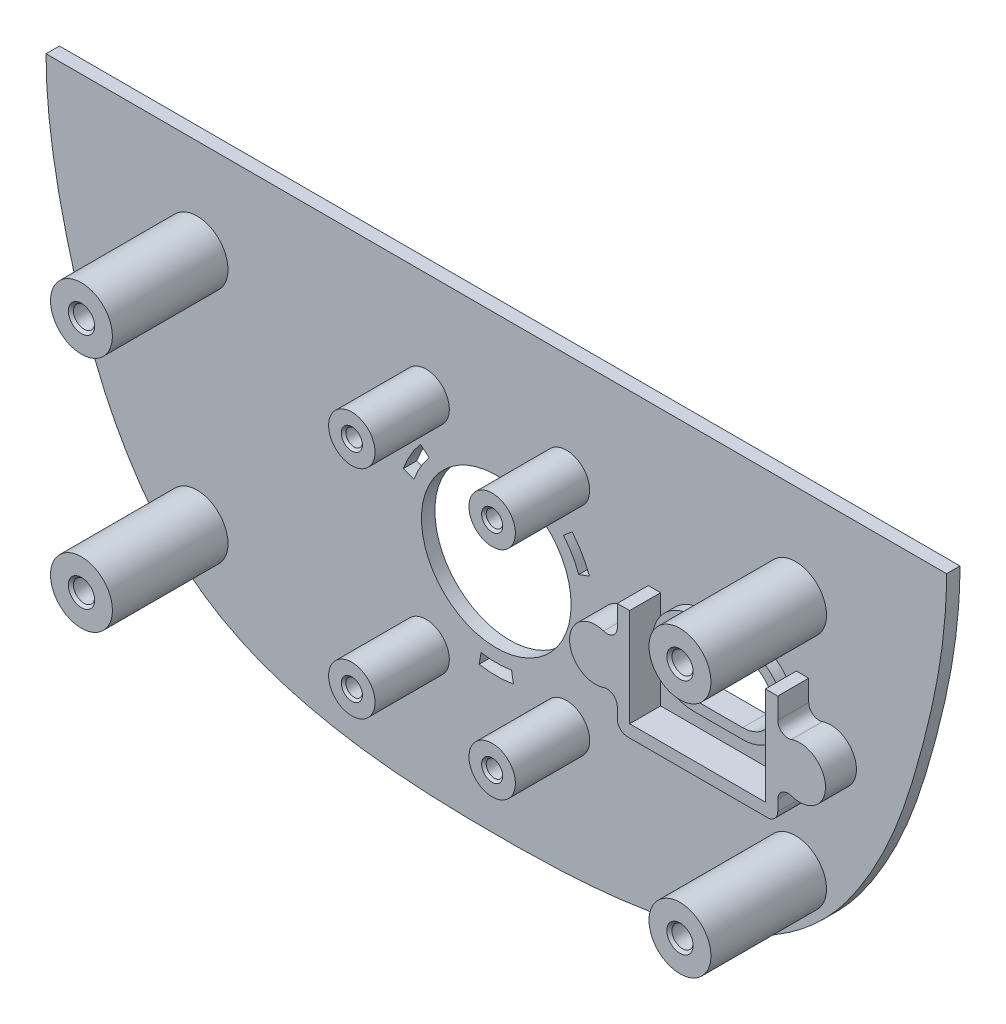
from build123d import *

# Parameters (mm, degrees)
EXTRUDE_1_DEPTH            = 1.3
SKETCH_2_R                 = 7.25
CUT_EXTRUDE_1_DEPTH        = 50.312390323
SKETCH_3_R                 = 3
SKETCH_3_R_2               = 2.25
EXTRUDE_2_DEPTH            = 7.2
SKETCH_4_R                 = 3
EXTRUDE_3_DEPTH            = 4
MIRROR_2_COPY_1_SKETCH_R   = 3
MIRROR_2_COPY_1_SKETCH_R_2 = 2.25
MIRROR_2_COPY_1_DEPTH      = 7.2
MIRROR_2_COPY_2_SKETCH_R   = 3
MIRROR_2_COPY_2_DEPTH      = 4
EXTRUDE_4_DEPTH            = 3
FILLET_1_R                 = 1
FILLET_2_R                 = 1
EXTRUDE_START              = 1
EXTRUDE_5_DEPTH            = 1
CUT_EXTRUDE_2_DEPTH        = 51.55157603


with BuildPart() as part:
    # 草图1 → 凸台-拉伸1 (new body)
    with BuildSketch(Plane.XY):
        with BuildLine():
            Line((-43.633908228, 20.8), (43.633908228, 20.8))
            add(Edge.make_bspline(
                [(43.633908228, 20.8), (43.633896186, 17.816441154), (43.166045606, 13.328317386), (41.935324687, 7.509911363), (40.780952583, 3.186512197), (39.471395291, -1.111683209), (37.800525429, -5.22041407), (35.689427738, -9.129621878), (33.132571088, -12.818032554), (29.982182395, -15.901512088), (26.249796115, -18.401728658), (22.196514099, -20.181654454), (16.429421746, -21.80470371), (9.014993789, -22.806165917), (0.016756126, -23.00176122), (-7.476640254, -22.840714569), (-13.430491813, -22.21049193), (-17.810447542, -21.410467341), (-22.102304365, -20.216812762), (-26.228858355, -18.41387049), (-29.298252959, -16.365199214), (-31.546858625, -14.375635283), (-33.552102976, -12.208905462), (-35.673711859, -9.157404868), (-37.81373488, -5.199904301), (-39.498586631, -1.033740187), (-41.230355142, 4.669994883), (-42.656919664, 10.435368542), (-43.478245905, 16.300477659), (-43.633914514, 19.304309804), (-43.633908228, 20.8)],
                knots=[0, 0, 0, 0, 0.0625, 0.09375, 0.125, 0.15625, 0.1875, 0.21875, 0.25, 0.28125, 0.3125, 0.34375, 0.375, 0.4375, 0.5, 0.5625, 0.59375, 0.625, 0.65625, 0.6875, 0.71875, 0.734375, 0.75, 0.78125, 0.8125, 0.84375, 0.875, 0.9375, 0.96875, 1, 1, 1, 1], degree=3))
        make_face()
    extrude(amount=-EXTRUDE_1_DEPTH)

    # 草图2 → 切除-拉伸1 (cut, through all)
    with BuildSketch(Plane.XY):
        Circle(SKETCH_2_R)
        with BuildLine():
            Line((20.125, 5), (24.875, 5))
            ThreePointArc((24.875, 5), (27.875, 2), (24.875, -1))
            Line((24.875, -1), (20.125, -1))
            ThreePointArc((20.125, -1), (17.125, 2), (20.125, 5))
        make_face()
    extrude(amount=-CUT_EXTRUDE_1_DEPTH, mode=Mode.SUBTRACT)

    # 草图3 → 凸台-拉伸2 (add)
    with BuildSketch(Plane.XY):
        with Locations((-29, 11.5)):
            Circle(SKETCH_3_R)
        with Locations((-6.8, 10.5)):
            Circle(SKETCH_3_R_2)
    extrude_2 = extrude(amount=EXTRUDE_2_DEPTH)

    # 草图4 → 凸台-拉伸3 (add)
    with BuildSketch(Plane.XY.offset(7.2)):
        with Locations((-29, 11.5)):
            Circle(SKETCH_4_R)
    extrude_3 = extrude(amount=EXTRUDE_3_DEPTH)

    # 草图6 → M2 螺纹孔1 (revolve, cut)
    with BuildSketch(Plane(origin=(-6.8, 10.5, 7.2), x_dir=(0, -1, 0), z_dir=(1, 0, 0))):
        Polygon((0, 0), (0, 5.680688495), (0.8, 5.2), (0.8, 0.225), (1.025, 0), align=None)
    hole_wizard_m2_1 = revolve(axis=Axis((-6.8, 10.5, 13.55), (0, 0, -1)), mode=Mode.SUBTRACT)

    # 草图8 → M2.5 螺纹孔1 (revolve, cut)
    with BuildSketch(Plane(origin=(-29, 11.5, 11.2), x_dir=(0, -1, 0), z_dir=(1, 0, 0))):
        Polygon((0, 0), (0, 6.965882135), (1.025, 6.35), (1.025, 0.25), (1.275, 0), align=None)
    hole_wizard_m2_5_1 = revolve(axis=Axis((-29, 11.5, 17.55), (0, 0, -1)), mode=Mode.SUBTRACT)

    # 镜向1: 凸台-拉伸2, 凸台-拉伸3, M2 螺纹孔1, M2.5 螺纹孔1 across plane
    add(extrude_2.mirror(Plane.ZX))
    add(extrude_3.mirror(Plane.ZX))
    add(hole_wizard_m2_1.mirror(Plane.ZX), mode=Mode.SUBTRACT)
    add(hole_wizard_m2_5_1.mirror(Plane.ZX), mode=Mode.SUBTRACT)

    # 镜向2: 凸台-拉伸2, 凸台-拉伸3, M2 螺纹孔1, M2.5 螺纹孔1 across plane
    add(extrude_2.mirror(Plane(origin=(0, 0, 0), x_dir=(0, 0, 1), z_dir=(1, 0, 0))))
    add(extrude_3.mirror(Plane(origin=(0, 0, 0), x_dir=(0, 0, 1), z_dir=(1, 0, 0))))
    add(hole_wizard_m2_1.mirror(Plane(origin=(0, 0, 0), x_dir=(0, 0, 1), z_dir=(1, 0, 0))), mode=Mode.SUBTRACT)
    add(hole_wizard_m2_5_1.mirror(Plane(origin=(0, 0, 0), x_dir=(0, 0, 1), z_dir=(1, 0, 0))), mode=Mode.SUBTRACT)

    # 镜向2 copy 1 sketch → 镜向2 copy 1 (add)
    with BuildSketch(Plane(origin=(0, 0, 0), x_dir=(-1, 0, 0), z_dir=(0, 0, 1))):
        with Locations((-29, 11.5)):
            Circle(MIRROR_2_COPY_1_SKETCH_R)
        with Locations((-6.8, 10.5)):
            Circle(MIRROR_2_COPY_1_SKETCH_R_2)
    extrude(amount=MIRROR_2_COPY_1_DEPTH)

    # 镜向2 copy 2 sketch → 镜向2 copy 2 (add)
    with BuildSketch(Plane(origin=(0, 0, 7.2), x_dir=(-1, 0, 0), z_dir=(0, 0, 1))):
        with Locations((-29, 11.5)):
            Circle(MIRROR_2_COPY_2_SKETCH_R)
    extrude(amount=MIRROR_2_COPY_2_DEPTH)

    # 镜向2 copy 3 sketch → 镜向2 copy 3 (revolve, cut)
    with BuildSketch(Plane(origin=(6.8, -10.5, 7.2), x_dir=(0, 1, 0), z_dir=(-1, 0, 0))):
        Polygon((0, 0), (0, 5.680688495), (0.8, 5.2), (0.8, 0.225), (1.025, 0), align=None)
    revolve(axis=Axis((6.8, -10.5, 13.55), (0, 0, -1)), mode=Mode.SUBTRACT)

    # 镜向2 copy 4 sketch → 镜向2 copy 4 (revolve, cut)
    with BuildSketch(Plane(origin=(29, -11.5, 11.2), x_dir=(0, 1, 0), z_dir=(-1, 0, 0))):
        Polygon((0, 0), (0, 6.965882135), (1.025, 6.35), (1.025, 0.25), (1.275, 0), align=None)
    revolve(axis=Axis((29, -11.5, 17.55), (0, 0, -1)), mode=Mode.SUBTRACT)

    # 草图9 → 凸台-拉伸4 (add)
    with BuildSketch(Plane.XY):
        with BuildLine():
            ThreePointArc((15.1, 0), (15.004423008, 0.684653197), (14.725, 1.316956719))
            Line((14.725, 1.316956719), (14.725, -1.316956719))
            ThreePointArc((14.725, -1.316956719), (15.004423008, -0.684653197), (15.1, 0))
        make_face()
        with BuildLine():
            Line((14.725, -1.316956719), (14.725, 1.316956719))
            ThreePointArc((14.725, 1.316956719), (10.1, 0), (14.725, -1.316956719))
        make_face()
        with BuildLine():
            Line((15.925, -4.15), (15.925, 5.35))
            Line((15.925, 5.35), (14.725, 5.35))
            Line((14.725, 5.35), (14.725, 1.316956719))
            ThreePointArc((14.725, 1.316956719), (15.004423008, 0.684653197), (15.1, 0))
            ThreePointArc((15.1, 0), (15.004423008, -0.684653197), (14.725, -1.316956719))
            Line((14.725, -1.316956719), (14.725, -5.35))
            Line((14.725, -5.35), (30.275, -5.35))
            Line((30.275, -5.35), (30.275, -1.316956719))
            ThreePointArc((30.275, -1.316956719), (29.9, 0), (30.275, 1.316956719))
            Line((30.275, 1.316956719), (30.275, 5.35))
            Line((30.275, 5.35), (29.075, 5.35))
            Line((29.075, 5.35), (29.075, -4.15))
            Line((29.075, -4.15), (15.925, -4.15))
        make_face()
        with BuildLine():
            ThreePointArc((34.9, 0), (33.084653197, 2.404423008), (30.275, 1.316956719))
            Line((30.275, 1.316956719), (30.275, -1.316956719))
            ThreePointArc((30.275, -1.316956719), (33.084653197, -2.404423008), (34.9, 0))
        make_face()
        with BuildLine():
            Line((30.275, -1.316956719), (30.275, 1.316956719))
            ThreePointArc((30.275, 1.316956719), (29.9, 0), (30.275, -1.316956719))
        make_face()
    extrude(amount=EXTRUDE_4_DEPTH)

    # 圆角1
    fillet_1_edges = [part.edges().sort_by_distance(p)[0] for p in [
        (14.725, -5.35, 1.5),
        (30.275, -5.35, 1.5),
    ]]
    fillet(fillet_1_edges, radius=FILLET_1_R)

    # 圆角2
    fillet_2_edges = [part.edges().sort_by_distance(p)[0] for p in [
        (14.725, 1.316956719, 1.5),
        (14.725, -1.316956719, 1.5),
        (30.275, -1.316956719, 1.5),
        (30.275, 1.316956719, 1.5),
    ]]
    fillet(fillet_2_edges, radius=FILLET_2_R)

    # 草图10 → 凸台-拉伸5 (add)
    with BuildSketch(Plane.XY.offset(EXTRUDE_START)):
        with BuildLine():
            Line((20.125, -2), (24.875, -2))
            ThreePointArc((24.875, -2), (28.875, 2), (24.875, 6))
            Line((24.875, 6), (20.125, 6))
            ThreePointArc((20.125, 6), (16.125, 2), (20.125, -2))
        make_face()
        with BuildLine():
            ThreePointArc((24.875, 5), (27.875, 2), (24.875, -1))
            Line((24.875, -1), (20.125, -1))
            ThreePointArc((20.125, -1), (17.125, 2), (20.125, 5))
            Line((20.125, 5), (24.875, 5))
        make_face(mode=Mode.SUBTRACT)
    extrude(amount=-EXTRUDE_5_DEPTH)

    # 草图11 → 切除-拉伸2 (cut, through all)
    with BuildSketch(Plane.XY):
        with BuildLine():
            ThreePointArc((-7.987387277, 2.907171218), (-7.361215932, 4.25), (-6.511377767, 5.463694682))
            Line((-6.511377767, 5.463694682), (-7.354026654, 6.170761053))
            ThreePointArc((-7.354026654, 6.170761053), (-8.313843876, 4.8), (-9.02104916, 3.283393376))
            Line((-9.02104916, 3.283393376), (-7.987387277, 2.907171218))
        make_face()
        with BuildLine():
            ThreePointArc((6.511377767, 5.463694682), (7.361215932, 4.25), (7.987387277, 2.907171218))
            Line((7.987387277, 2.907171218), (9.02104916, 3.283393376))
            ThreePointArc((9.02104916, 3.283393376), (8.313843876, 4.8), (7.354026654, 6.170761053))
            Line((7.354026654, 6.170761053), (6.511377767, 5.463694682))
        make_face()
        with BuildLine():
            ThreePointArc((1.47600951, -8.370865901), (0, -8.5), (-1.47600951, -8.370865901))
            Line((-1.47600951, -8.370865901), (-1.667022506, -9.454154429))
            ThreePointArc((-1.667022506, -9.454154429), (0, -9.6), (1.667022506, -9.454154429))
            Line((1.667022506, -9.454154429), (1.47600951, -8.370865901))
        make_face()
    extrude(amount=-CUT_EXTRUDE_2_DEPTH, mode=Mode.SUBTRACT)


solid = part.part
